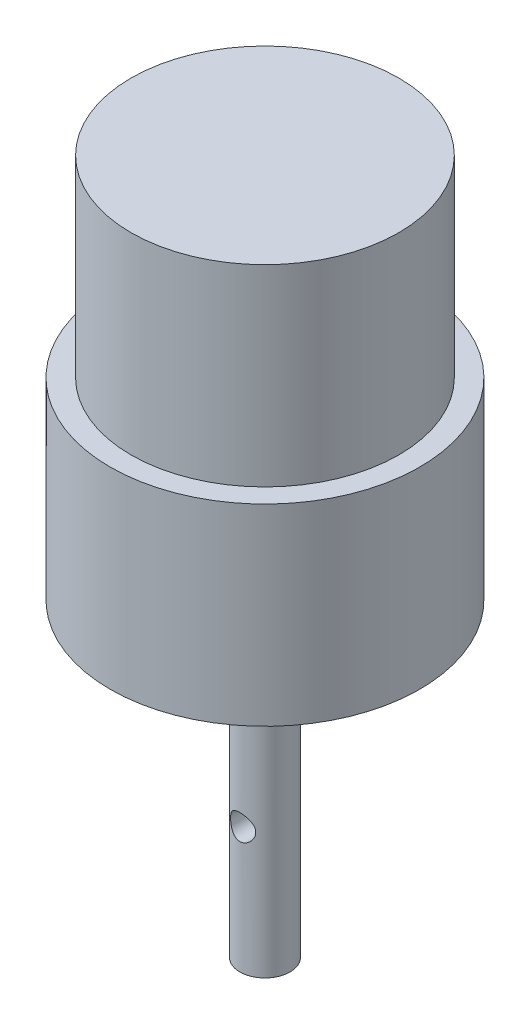
from build123d import *

# Parameters (mm, degrees)
SKETCH2_R               = 18.5
BOSS_EXTRUDE1_DEPTH     = 23
SKETCH3_R               = 16
BOSS_EXTRUDE2_DEPTH     = 23
SKETCH4_R               = 7
BOSS_EXTRUDE3_DEPTH     = 8
SKETCH12_R              = 3
BOSS_EXTRUDE6_DEPTH     = 37
CUT_EXTRUDE1_DEPTH      = 10
CUT_EXTRUDE1_DEPTH_BACK = 10
SKETCH7_R               = 1.5


with BuildPart() as part:
    # Sketch2 → Boss-Extrude1 (new body)
    with BuildSketch(Plane(origin=(0, 0, 0), x_dir=(1, 0, 0), z_dir=(0, 1, 0))):
        Circle(SKETCH2_R)
    extrude(amount=BOSS_EXTRUDE1_DEPTH)

    # Sketch3 → Boss-Extrude2 (add)
    with BuildSketch(Plane(origin=(0, 23, 0), x_dir=(1, 0, 0), z_dir=(0, 1, 0))):
        Circle(SKETCH3_R)
    extrude(amount=BOSS_EXTRUDE2_DEPTH)

    # Sketch4 → Boss-Extrude3 (add)
    with BuildSketch(Plane.XZ):
        Circle(SKETCH4_R)
    extrude(amount=BOSS_EXTRUDE3_DEPTH)

    # Sketch12 → Boss-Extrude6 (add)
    with BuildSketch(Plane(origin=(0, 0, 0), x_dir=(1, 0, 0), z_dir=(0, 1, 0))):
        Circle(SKETCH12_R)
    extrude(amount=-BOSS_EXTRUDE6_DEPTH)

    # Sketch7 → Cut-Extrude1 (cut, two sides: drawn at the far end of the back side and taken through both)
    with BuildSketch(Plane.XY.offset(-CUT_EXTRUDE1_DEPTH_BACK)):
        with Locations((0, -22)):
            Circle(SKETCH7_R)
    extrude(amount=CUT_EXTRUDE1_DEPTH + CUT_EXTRUDE1_DEPTH_BACK, mode=Mode.SUBTRACT)


solid = part.part
